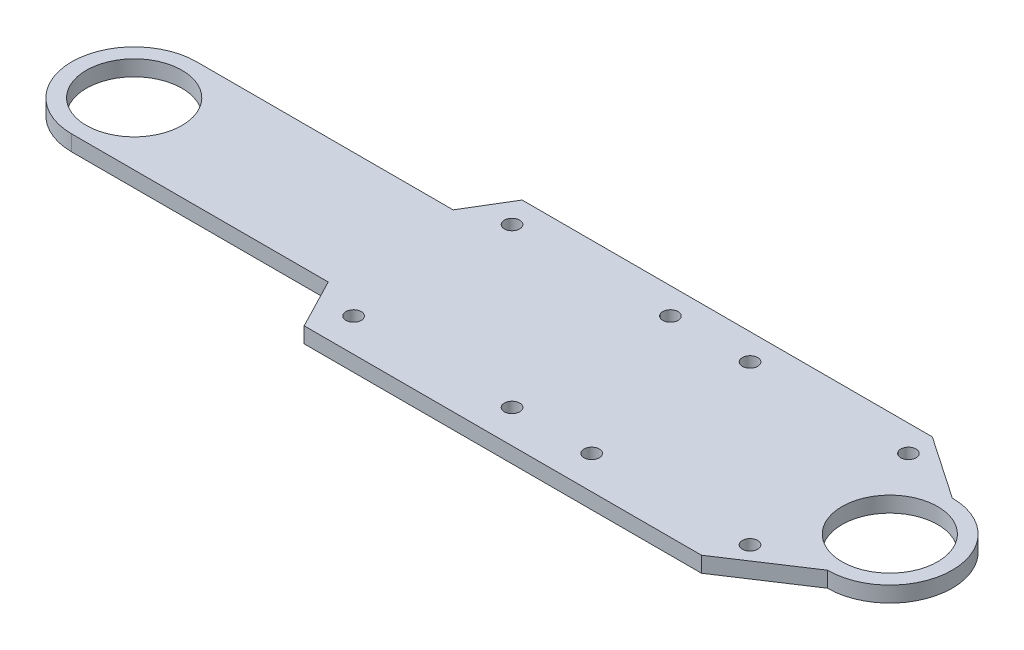
from build123d import *

# Parameters (mm, degrees)
SKETCH5_W          = 50.68
SKETCH5_H          = 3.06
EXTRUDE2_DEPTH     = 180
SKETCH6_R          = 9.36
SKETCH6_R_2        = 1.5
CUT_EXTRUDE3_DEPTH = 182.800657865
SKETCH7_W          = 77.752773683
SKETCH7_H          = 3.335005788
CUT_EXTRUDE4_DEPTH = 178.825100476


with BuildPart() as part:
    # Sketch5 → Extrude2 (new body)
    with BuildSketch(Plane(origin=(0, 0, 0), x_dir=(0, 0, -1), z_dir=(1, 0, 0))):
        Rectangle(SKETCH5_W, SKETCH5_H)
    extrude(amount=EXTRUDE2_DEPTH)

    # Sketch6 → Cut-Extrude3 (cut, through all)
    with BuildSketch(Plane(origin=(0, 1.53, 0), x_dir=(-1, 0, 0), z_dir=(0, 1, 0))):
        with Locations(Location((-15.875, 0, 0), (0, 0, 90))):
            Circle(SKETCH6_R)
        with Locations(Location((-74.32, -15.5, 0), (0, 0, 90))):
            Circle(SKETCH6_R_2)
        with Locations(Location((-74.32, 15.5, 0), (0, 0, 90))):
            Circle(SKETCH6_R_2)
        with Locations(Location((-105.32, -15.5, 0), (0, 0, 90))):
            Circle(SKETCH6_R_2)
        with Locations(Location((-105.32, 15.5, 0), (0, 0, 90))):
            Circle(SKETCH6_R_2)
        with Locations(Location((-120.9, -15.5, 0), (0, 0, 90))):
            Circle(SKETCH6_R_2)
        with Locations(Location((-120.9, 15.5, 0), (0, 0, 90))):
            Circle(SKETCH6_R_2)
        with Locations(Location((-151.9, -15.5, 0), (0, 0, 90))):
            Circle(SKETCH6_R_2)
        with Locations(Location((-151.9, 15.5, 0), (0, 0, 90))):
            Circle(SKETCH6_R_2)
        with Locations(Location((-163.76, 0, 0), (0, 0, 90))):
            Circle(SKETCH6_R)
        with BuildLine():
            Line((-163.76, 12.223769591), (-148.9, 22.004994212))
            Line((-148.9, 22.004994212), (-148.9, 25.34))
            Line((-148.9, 25.34), (-180, 25.34))
            Line((-180, 25.34), (-180, -25.34))
            Line((-180, -25.34), (0, -25.34))
            Line((0, -25.34), (0, 25.34))
            Line((0, 25.34), (-71.147226317, 25.34))
            Line((-71.147226317, 25.34), (-71.147226317, 22.004994212))
            Line((-71.147226317, 22.004994212), (-66.075480217, 12.223769591))
            Line((-66.075480217, 12.223769591), (-15.875, 12.223769591))
            ThreePointArc((-15.875, 12.223769591), (-3.651230409, 0), (-15.875, -12.223769591))
            Line((-15.875, -12.223769591), (-66.075480217, -12.223769591))
            Line((-66.075480217, -12.223769591), (-71.147226317, -20.64))
            Line((-71.147226317, -20.64), (-151.43711062, -20.64))
            Line((-151.43711062, -20.64), (-163.76, -12.223769591))
            ThreePointArc((-163.76, -12.223769591), (-175.983769591, 0), (-163.76, 12.223769591))
        make_face()
    extrude(amount=-CUT_EXTRUDE3_DEPTH, mode=Mode.SUBTRACT)

    # Sketch7 → Cut-Extrude4 (cut, through all)
    with BuildSketch(Plane(origin=(0, 1.53, 0), x_dir=(-1, 0, 0), z_dir=(0, 1, 0))):
        with Locations((-110.023613159, 23.672497106)):
            Rectangle(SKETCH7_W, SKETCH7_H)
    extrude(amount=-CUT_EXTRUDE4_DEPTH, mode=Mode.SUBTRACT)


solid = part.part
